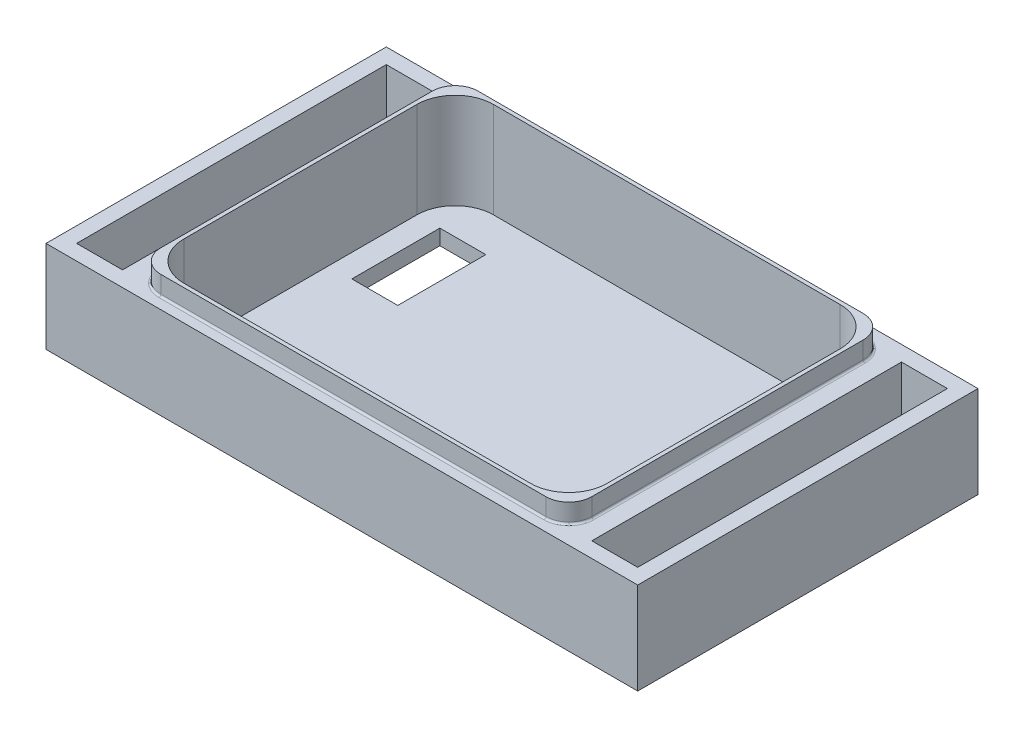
from build123d import *

# Parameters (mm, degrees)
SKETCH1_W           = 59.31
SKETCH1_H           = 44.46
BOSS_EXTRUDE1_DEPTH = 2
SKETCH2_W           = 59.31
SKETCH2_H           = 44.46
SKETCH2_W_2         = 55.31
SKETCH2_H_2         = 40.46
BOSS_EXTRUDE2_DEPTH = 12.5
SKETCH3_W           = 1.5
SKETCH3_H           = 2.5
SKETCH5_W           = 6
SKETCH5_H           = 11.5
CUT_EXTRUDE1_DEPTH  = 10
BOSS_EXTRUDE3_DEPTH = 2
FILLET1_R           = 5
SKETCH7_W           = 10
SKETCH7_H           = 44.46
SKETCH7_W_2         = 6
SKETCH7_H_2         = 40.46
BOSS_EXTRUDE4_DEPTH = 12
FILLET2_R           = 3
FILLET3_R           = 0.25


with BuildPart() as part:
    # Sketch1 → Boss-Extrude1 (new body)
    with BuildSketch(Plane(origin=(0, 0, 0), x_dir=(1, 0, 0), z_dir=(0, 1, 0))):
        Rectangle(SKETCH1_W, SKETCH1_H)
    extrude(amount=BOSS_EXTRUDE1_DEPTH)

    # Sketch2 → Boss-Extrude2 (add)
    with BuildSketch(Plane(origin=(0, 2, 0), x_dir=(1, 0, 0), z_dir=(0, 1, 0))):
        Rectangle(SKETCH2_W, SKETCH2_H)
        Rectangle(SKETCH2_W_2, SKETCH2_H_2, mode=Mode.SUBTRACT)
    extrude(amount=BOSS_EXTRUDE2_DEPTH)

    # Cut-Sweep1: sweep along a path in Sketch4
    with BuildLine(Plane(origin=(0, 14.5, 0), x_dir=(1, 0, 0), z_dir=(0, 1, 0))) as cut_sweep1_path:
        Line((-29.655, -22.23), (29.655, -22.23))
        Line((29.655, -22.23), (29.655, 22.23))
        Line((29.655, 22.23), (-29.655, 22.23))
        Line((-29.655, 22.23), (-29.655, -22.23))
    # Sketch3 → Cut-Sweep1 (sweep, cut)
    with BuildSketch(Plane(origin=(29.655, 0, 0), x_dir=(0, 0, -1), z_dir=(1, 0, 0))):
        with Locations((-21.48, 13.25)):
            Rectangle(SKETCH3_W, SKETCH3_H)
    sweep(path=cut_sweep1_path.line, transition=Transition.RIGHT, mode=Mode.SUBTRACT)

    # Sketch5 → Cut-Extrude1 (cut)
    with BuildSketch(Plane(origin=(0, 0, 0), x_dir=(-1, 0, 0), z_dir=(0, -1, 0))):
        with Locations((21.655, 9.48)):
            Rectangle(SKETCH5_W, SKETCH5_H)
    extrude(amount=-CUT_EXTRUDE1_DEPTH, mode=Mode.SUBTRACT)

    # Sketch6 → Boss-Extrude3 (add)
    with BuildSketch(Plane.XZ):
        with BuildLine():
            Line((3.668359532, 11.043003806), (5.069466615, 11.043003806))
            Line((5.069466615, 11.043003806), (13.724692633, -5.981200546))
            add(Edge.make_bspline(
                [(13.724692633, -5.981200546), (13.770465415, -6.066255609), (13.860276332, -6.233142412), (14.049596398, -6.44471403), (14.259282132, -6.635498751), (14.514562764, -6.779774023), (14.797989941, -6.899882103), (15.118123905, -6.972877212), (15.467702486, -7.031048399), (15.713066528, -7.034166281), (15.841418927, -7.035797276)],
                knots=[0, 0, 0, 0, 0.923122777, 1.811262043, 2.707284477, 3.630407254, 4.607627564, 5.650245945, 6.770820012, 8, 8, 8, 8], degree=3))
            Line((15.841418927, -7.035797276), (16.587169471, -7.035797276))
            Line((16.587169471, -7.035797276), (16.587169471, -8))
            Line((16.587169471, -8), (6.704091546, -8))
            Line((6.704091546, -8), (6.704091546, -7.035797276))
            Line((6.704091546, -7.035797276), (7.491272677, -7.035797276))
            add(Edge.make_bspline(
                [(7.491272677, -7.035797276), (7.615561715, -7.034972065), (7.854152468, -7.033387954), (8.197254943, -7.024270941), (8.510837169, -6.998643255), (8.797935797, -6.976226749), (9.056099226, -6.935998597), (9.287242582, -6.897915489), (9.488634661, -6.845109649), (9.610791127, -6.800614432), (9.66826164, -6.779680927)],
                knots=[0, 0, 0, 0, 1.354335262, 2.59984206, 3.738199698, 4.78223889, 5.735982514, 6.583888141, 7.33376694, 8, 8, 8, 8], degree=3))
            add(Edge.make_bspline(
                [(9.66826164, -6.779680927), (9.734616654, -6.749406693), (9.857910933, -6.693154125), (9.99935023, -6.559441952), (10.092017823, -6.401790611), (10.10075551, -6.2849798), (10.105166, -6.226017644)],
                knots=[0, 0, 0, 0, 1.157571245, 2.15088362, 3.06662844, 4, 4, 4, 4], degree=3))
            add(Edge.make_bspline(
                [(10.105166, -6.226017644), (10.098921578, -6.149754311), (10.08575846, -5.988992716), (10.021947105, -5.840695302), (9.988407076, -5.762748366)],
                knots=[0, 0, 0, 0, 0.948775522, 2, 2, 2, 2], degree=3))
            Line((9.988407076, -5.762748366), (7.939476287, -1.732682292))
            Line((7.939476287, -1.732682292), (-1.495398027, -1.732682292))
            Line((-1.495398027, -1.732682292), (-2.666753681, -4.045262263))
            add(Edge.make_bspline(
                [(-2.666753681, -4.045262263), (-2.73463111, -4.18986222), (-2.860946743, -4.458953658), (-2.99975414, -4.849828516), (-3.097335174, -5.191789881), (-3.109447861, -5.40819885), (-3.114957291, -5.506632017)],
                knots=[0, 0, 0, 0, 1.244034282, 2.315069679, 3.233612959, 4, 4, 4, 4], degree=3))
            add(Edge.make_bspline(
                [(-3.114957291, -5.506632017), (-3.105178856, -5.610008506), (-3.085538794, -5.817640973), (-2.930679332, -6.11109022), (-2.683549261, -6.372065908), (-2.348052402, -6.608977598), (-1.921244388, -6.804306269), (-1.406472367, -6.937233956), (-0.80918362, -7.025851211), (-0.382171294, -7.032338986), (-0.154553614, -7.035797276)],
                knots=[0, 0, 0, 0, 0.676796425, 1.359350793, 2.130179084, 3.02304161, 4.041766613, 5.196580708, 6.505645488, 8, 8, 8, 8], degree=3))
            Line((-0.154553614, -7.035797276), (0.677824519, -7.035797276))
            Line((0.677824519, -7.035797276), (0.677824519, -8))
            Line((0.677824519, -8), (-8.241050681, -8))
            Line((-8.241050681, -8), (-8.241050681, -7.035797276))
            add(Edge.make_bspline(
                [(-8.241050681, -7.035797276), (-8.00595871, -7.030682959), (-7.560198321, -7.020985648), (-6.930404722, -6.931476506), (-6.376944833, -6.783238723), (-5.886269273, -6.568068877), (-5.442332689, -6.26093688), (-5.039212162, -5.844454164), (-4.645254972, -5.330344026), (-4.423041234, -4.933672593), (-4.305145029, -4.723217304)],
                knots=[0, 0, 0, 0, 1.157126977, 2.194040787, 3.123941644, 3.970721164, 4.81957436, 5.763811563, 6.813583119, 8, 8, 8, 8], degree=3))
            Line((-4.305145029, -4.723217304), (3.668359532, 11.043003806))
        make_face()
        Polygon((3.208856671, 7.570367432), (-1.009530248, -0.768479567), (7.446075674, -0.768479567), align=None, mode=Mode.SUBTRACT)
    extrude(amount=BOSS_EXTRUDE3_DEPTH)

    # Fillet1
    fillet1_edges = [part.edges().sort_by_distance(p)[0] for p in [
        (27.655, 8.25, 20.23),
        (27.655, 8.25, -20.23),
        (-27.655, 8.25, -20.23),
        (-27.655, 8.25, 20.23),
    ]]
    fillet(fillet1_edges, radius=FILLET1_R)

    # Sketch7 → Boss-Extrude4 (add)
    # profile 1 of 2: a face of its own
    with BuildSketch(Plane.XZ):
        with Locations((-33.655, 0)):
            Rectangle(SKETCH7_W, SKETCH7_H)
        with Locations((-33.655, 0)):
            Rectangle(SKETCH7_W_2, SKETCH7_H_2, mode=Mode.SUBTRACT)
    # profile 2 of 2: a face of its own
    with BuildSketch(Plane.XZ):
        with Locations((33.655, 0)):
            Rectangle(SKETCH7_W, SKETCH7_H)
        with Locations((33.655, 0)):
            Rectangle(SKETCH7_W_2, SKETCH7_H_2, mode=Mode.SUBTRACT)
    extrude(amount=-BOSS_EXTRUDE4_DEPTH)

    # Fillet2
    fillet2_edges = [part.edges().sort_by_distance(p)[0] for p in [
        (-28.155, 13.25, -20.73),
        (28.155, 13.25, -20.73),
        (28.155, 13.25, 20.73),
        (-28.155, 13.25, 20.73),
    ]]
    fillet(fillet2_edges, radius=FILLET2_R)

    # Fillet3
    fillet3_edges = [part.edges().sort_by_distance(p)[0] for p in [
        (-28.155, 12, 0),
        (0, 12, -20.73),
        (28.155, 12, 0),
        (0, 12, 20.73),
        (-27.276320344, 12, -19.851320344),
        (27.276320344, 12, -19.851320344),
        (27.276320344, 12, 19.851320344),
        (-27.276320344, 12, 19.851320344),
    ]]
    fillet(fillet3_edges, radius=FILLET3_R)


solid = part.part
